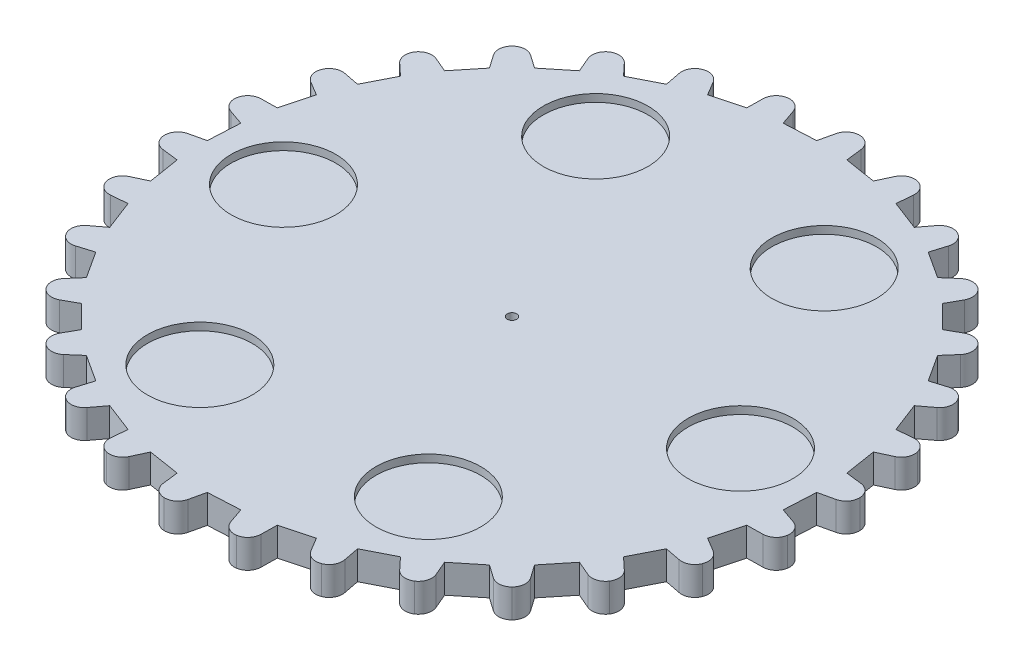
from build123d import *

# Parameters (mm, degrees)
BOSS_EXTRUDE2_DEPTH = 19.05
SKETCH3_R           = 34.925
CUT_EXTRUDE1_DEPTH  = 5.08
SKETCH4_R           = 3.175
CUT_EXTRUDE2_DEPTH  = 313.58717045


with BuildPart() as part:
    # Sketch2 → Boss-Extrude2 (new body)
    with BuildSketch(Plane(origin=(0, 0, 0), x_dir=(1, 0, 0), z_dir=(0, 1, 0))):
        with BuildLine():
            Line((42.247655574, 198.759592469), (0, 0))
            Line((0, 0), (0, 203.2))
            Line((0, 203.2), (-21.240183736, 202.086849139))
            Line((-21.240183736, 202.086849139), (-24.759086907, 212.306486006))
            ThreePointArc((-24.759086907, 212.306486006), (-28.586058558, 217.032402416), (-34.555449438, 218.192734461))
            Line((-34.555449438, 218.192734461), (-34.561077636, 218.191843042))
            ThreePointArc((-34.561077636, 218.191843042), (-39.87974341, 215.243658462), (-42.059021251, 209.566445587))
            Line((-42.059021251, 209.566445587), (-42.247655574, 198.759592469))
            Line((-42.247655574, 198.759592469), (-62.792253257, 193.254684111))
            Line((-62.792253257, 193.254684111), (-68.359041932, 202.519376285))
            ThreePointArc((-68.359041932, 202.519376285), (-73.084958342, 206.346347936), (-79.165150306, 206.24021779))
            Line((-79.165150306, 206.24021779), (-79.170470177, 206.238175683))
            ThreePointArc((-79.170470177, 206.238175683), (-83.759948302, 202.248603216), (-84.711244767, 196.242353723))
            Line((-84.711244767, 196.242353723), (-82.648885873, 185.632436993))
            Line((-82.648885873, 185.632436993), (-101.6, 175.976362049))
            Line((-101.6, 175.976362049), (-108.971378801, 183.881198024))
            ThreePointArc((-108.971378801, 183.881198024), (-114.389694745, 186.641967892), (-120.314954229, 185.274013953))
            Line((-120.314954229, 185.274013953), (-120.319733271, 185.270910407))
            ThreePointArc((-120.319733271, 185.270910407), (-123.97944153, 180.414313513), (-123.661180396, 174.341529326))
            Line((-123.661180396, 174.341529326), (-119.437963266, 164.392253257))
            Line((-119.437963266, 164.392253257), (-135.967339212, 151.007028537))
            Line((-135.967339212, 151.007028537), (-144.821143513, 157.206529051))
            ThreePointArc((-144.821143513, 157.206529051), (-150.695052585, 158.780438243), (-156.206417317, 156.210446662))
            Line((-156.206417317, 156.210446662), (-156.210446662, 156.206417317))
            ThreePointArc((-156.210446662, 156.206417317), (-158.780438243, 150.695052585), (-157.206529051, 144.821143513))
            Line((-157.206529051, 144.821143513), (-151.007028537, 135.967339212))
            Line((-151.007028537, 135.967339212), (-164.392253257, 119.437963266))
            Line((-164.392253257, 119.437963266), (-174.341529326, 123.661180396))
            ThreePointArc((-174.341529326, 123.661180396), (-180.414313513, 123.97944153), (-185.270910407, 120.319733271))
            Line((-185.270910407, 120.319733271), (-185.274013953, 120.314954229))
            ThreePointArc((-185.274013953, 120.314954229), (-186.641967892, 114.389694745), (-183.881198024, 108.971378801))
            Line((-183.881198024, 108.971378801), (-175.976362049, 101.6))
            Line((-175.976362049, 101.6), (-185.632436993, 82.648885873))
            Line((-185.632436993, 82.648885873), (-196.242353723, 84.711244767))
            ThreePointArc((-196.242353723, 84.711244767), (-202.248603216, 83.759948302), (-206.238175683, 79.170470177))
            Line((-206.238175683, 79.170470177), (-206.24021779, 79.165150306))
            ThreePointArc((-206.24021779, 79.165150306), (-206.346347936, 73.084958342), (-202.519376285, 68.359041932))
            Line((-202.519376285, 68.359041932), (-193.254684111, 62.792253257))
            Line((-193.254684111, 62.792253257), (-198.759592469, 42.247655574))
            Line((-198.759592469, 42.247655574), (-209.566445587, 42.059021251))
            ThreePointArc((-209.566445587, 42.059021251), (-215.243658462, 39.87974341), (-218.191843042, 34.561077636))
            Line((-218.191843042, 34.561077636), (-218.192734461, 34.555449438))
            ThreePointArc((-218.192734461, 34.555449438), (-217.032402416, 28.586058558), (-212.306486006, 24.759086907))
            Line((-212.306486006, 24.759086907), (-202.086849139, 21.240183736))
            Line((-202.086849139, 21.240183736), (-203.2, 0))
            Line((-203.2, 0), (-213.731478168, -2.431383314))
            ThreePointArc((-213.731478168, -2.431383314), (-218.831532979, -5.743397635), (-220.609479859, -11.558799841))
            Line((-220.609479859, -11.558799841), (-220.60918163, -11.564490385))
            ThreePointArc((-220.60918163, -11.564490385), (-218.233099473, -17.162189155), (-212.814783529, -19.922959023))
            Line((-212.814783529, -19.922959023), (-202.086849139, -21.240183736))
            Line((-202.086849139, -21.240183736), (-198.759592469, -42.247655574))
            Line((-198.759592469, -42.247655574), (-208.555419555, -46.815524762))
            ThreePointArc((-208.555419555, -46.815524762), (-212.855419435, -51.115524642), (-213.385423804, -57.1735023))
            Line((-213.385423804, -57.1735023), (-213.383948962, -57.179006487))
            ThreePointArc((-213.383948962, -57.179006487), (-209.895962885, -62.16036685), (-204.022053813, -63.734276042))
            Line((-204.022053813, -63.734276042), (-193.254684111, -62.792253257))
            Line((-193.254684111, -62.792253257), (-185.632436993, -82.648885873))
            Line((-185.632436993, -82.648885873), (-194.264488348, -89.153603132))
            ThreePointArc((-194.264488348, -89.153603132), (-197.576502668, -94.253657944), (-196.835400792, -100.289448359))
            Line((-196.835400792, -100.289448359), (-196.832813794, -100.294525629))
            ThreePointArc((-196.832813794, -100.294525629), (-192.385365526, -104.441838234), (-186.312581339, -104.760099367))
            Line((-186.312581339, -104.760099367), (-175.976362049, -101.6))
            Line((-175.976362049, -101.6), (-164.392253257, -119.437963266))
            Line((-164.392253257, -119.437963266), (-171.483266816, -127.595241239))
            ThreePointArc((-171.483266816, -127.595241239), (-173.662544657, -133.272454113), (-171.682726245, -139.022264283))
            Line((-171.682726245, -139.022264283), (-171.679140155, -139.026692735))
            ThreePointArc((-171.679140155, -139.026692735), (-166.466604526, -142.15870012), (-160.460355034, -141.207403655))
            Line((-160.460355034, -141.207403655), (-151.007028537, -135.967339212))
            Line((-151.007028537, -135.967339212), (-135.967339212, -151.007028537))
            Line((-135.967339212, -151.007028537), (-141.207403655, -160.460355034))
            ThreePointArc((-141.207403655, -160.460355034), (-142.15870012, -166.466604526), (-139.026692735, -171.679140155))
            Line((-139.026692735, -171.679140155), (-139.022264283, -171.682726245))
            ThreePointArc((-139.022264283, -171.682726245), (-133.272454113, -173.662544657), (-127.595241239, -171.483266816))
            Line((-127.595241239, -171.483266816), (-119.437963266, -164.392253257))
            Line((-119.437963266, -164.392253257), (-101.6, -175.976362049))
            Line((-101.6, -175.976362049), (-104.760099367, -186.312581339))
            ThreePointArc((-104.760099367, -186.312581339), (-104.441838234, -192.385365526), (-100.294525629, -196.832813794))
            Line((-100.294525629, -196.832813794), (-100.289448359, -196.835400792))
            ThreePointArc((-100.289448359, -196.835400792), (-94.253657944, -197.576502668), (-89.153603132, -194.264488348))
            Line((-89.153603132, -194.264488348), (-82.648885873, -185.632436993))
            Line((-82.648885873, -185.632436993), (-62.792253257, -193.254684111))
            Line((-62.792253257, -193.254684111), (-63.734276042, -204.022053813))
            ThreePointArc((-63.734276042, -204.022053813), (-62.16036685, -209.895962885), (-57.179006487, -213.383948962))
            Line((-57.179006487, -213.383948962), (-57.1735023, -213.385423804))
            ThreePointArc((-57.1735023, -213.385423804), (-51.115524642, -212.855419435), (-46.815524762, -208.555419555))
            Line((-46.815524762, -208.555419555), (-42.247655574, -198.759592469))
            Line((-42.247655574, -198.759592469), (-21.240183736, -202.086849139))
            Line((-21.240183736, -202.086849139), (-19.922959023, -212.814783529))
            ThreePointArc((-19.922959023, -212.814783529), (-17.162189155, -218.233099473), (-11.564490385, -220.60918163))
            Line((-11.564490385, -220.60918163), (-11.558799841, -220.609479859))
            ThreePointArc((-11.558799841, -220.609479859), (-5.743397635, -218.831532979), (-2.431383314, -213.731478168))
            Line((-2.431383314, -213.731478168), (0, -203.2))
            Line((0, -203.2), (21.240183736, -202.086849139))
            Line((21.240183736, -202.086849139), (24.759086907, -212.306486006))
            ThreePointArc((24.759086907, -212.306486006), (28.586058558, -217.032402416), (34.555449438, -218.192734461))
            Line((34.555449438, -218.192734461), (34.561077636, -218.191843042))
            ThreePointArc((34.561077636, -218.191843042), (39.87974341, -215.243658462), (42.059021251, -209.566445587))
            Line((42.059021251, -209.566445587), (42.247655574, -198.759592469))
            Line((42.247655574, -198.759592469), (62.792253257, -193.254684111))
            Line((62.792253257, -193.254684111), (68.359041932, -202.519376285))
            ThreePointArc((68.359041932, -202.519376285), (73.084958342, -206.346347936), (79.165150306, -206.24021779))
            Line((79.165150306, -206.24021779), (79.170470177, -206.238175683))
            ThreePointArc((79.170470177, -206.238175683), (83.759948302, -202.248603216), (84.711244767, -196.242353723))
            Line((84.711244767, -196.242353723), (82.648885873, -185.632436993))
            Line((82.648885873, -185.632436993), (101.6, -175.976362049))
            Line((101.6, -175.976362049), (108.971378801, -183.881198024))
            ThreePointArc((108.971378801, -183.881198024), (114.389694745, -186.641967892), (120.314954229, -185.274013953))
            Line((120.314954229, -185.274013953), (120.319733271, -185.270910407))
            ThreePointArc((120.319733271, -185.270910407), (123.97944153, -180.414313513), (123.661180396, -174.341529326))
            Line((123.661180396, -174.341529326), (119.437963266, -164.392253257))
            Line((119.437963266, -164.392253257), (135.967339212, -151.007028537))
            Line((135.967339212, -151.007028537), (144.821143513, -157.206529051))
            ThreePointArc((144.821143513, -157.206529051), (150.695052585, -158.780438243), (156.206417317, -156.210446662))
            Line((156.206417317, -156.210446662), (156.210446662, -156.206417317))
            ThreePointArc((156.210446662, -156.206417317), (158.780438243, -150.695052585), (157.206529051, -144.821143513))
            Line((157.206529051, -144.821143513), (151.007028537, -135.967339212))
            Line((151.007028537, -135.967339212), (164.392253257, -119.437963266))
            Line((164.392253257, -119.437963266), (174.341529326, -123.661180396))
            ThreePointArc((174.341529326, -123.661180396), (180.414313513, -123.97944153), (185.270910407, -120.319733271))
            Line((185.270910407, -120.319733271), (185.274013953, -120.314954229))
            ThreePointArc((185.274013953, -120.314954229), (186.641967892, -114.389694745), (183.881198024, -108.971378801))
            Line((183.881198024, -108.971378801), (175.976362049, -101.6))
            Line((175.976362049, -101.6), (185.632436993, -82.648885873))
            Line((185.632436993, -82.648885873), (196.242353723, -84.711244767))
            ThreePointArc((196.242353723, -84.711244767), (202.248603216, -83.759948302), (206.238175683, -79.170470177))
            Line((206.238175683, -79.170470177), (206.24021779, -79.165150306))
            ThreePointArc((206.24021779, -79.165150306), (206.346347936, -73.084958342), (202.519376285, -68.359041932))
            Line((202.519376285, -68.359041932), (193.254684111, -62.792253257))
            Line((193.254684111, -62.792253257), (198.759592469, -42.247655574))
            Line((198.759592469, -42.247655574), (209.566445587, -42.059021251))
            ThreePointArc((209.566445587, -42.059021251), (215.243658462, -39.87974341), (218.191843042, -34.561077636))
            Line((218.191843042, -34.561077636), (218.192734461, -34.555449438))
            ThreePointArc((218.192734461, -34.555449438), (217.032402416, -28.586058558), (212.306486006, -24.759086907))
            Line((212.306486006, -24.759086907), (202.086849139, -21.240183736))
            Line((202.086849139, -21.240183736), (203.2, 0))
            Line((203.2, 0), (213.731478168, 2.431383314))
            ThreePointArc((213.731478168, 2.431383314), (218.831532979, 5.743397635), (220.609479859, 11.558799841))
            Line((220.609479859, 11.558799841), (220.60918163, 11.564490385))
            ThreePointArc((220.60918163, 11.564490385), (218.233099473, 17.162189155), (212.814783529, 19.922959023))
            Line((212.814783529, 19.922959023), (202.086849139, 21.240183736))
            Line((202.086849139, 21.240183736), (198.759592469, 42.247655574))
            Line((198.759592469, 42.247655574), (208.555419555, 46.815524762))
            ThreePointArc((208.555419555, 46.815524762), (212.855419435, 51.115524642), (213.385423804, 57.1735023))
            Line((213.385423804, 57.1735023), (213.383948962, 57.179006487))
            ThreePointArc((213.383948962, 57.179006487), (209.895962885, 62.16036685), (204.022053813, 63.734276042))
            Line((204.022053813, 63.734276042), (193.254684111, 62.792253257))
            Line((193.254684111, 62.792253257), (185.632436993, 82.648885873))
            Line((185.632436993, 82.648885873), (194.264488348, 89.153603132))
            ThreePointArc((194.264488348, 89.153603132), (197.576502668, 94.253657944), (196.835400792, 100.289448359))
            Line((196.835400792, 100.289448359), (196.832813794, 100.294525629))
            ThreePointArc((196.832813794, 100.294525629), (192.385365526, 104.441838234), (186.312581339, 104.760099367))
            Line((186.312581339, 104.760099367), (175.976362049, 101.6))
            Line((175.976362049, 101.6), (164.392253257, 119.437963266))
            Line((164.392253257, 119.437963266), (171.483266816, 127.595241239))
            ThreePointArc((171.483266816, 127.595241239), (173.662544657, 133.272454113), (171.682726245, 139.022264283))
            Line((171.682726245, 139.022264283), (171.679140155, 139.026692735))
            ThreePointArc((171.679140155, 139.026692735), (166.466604526, 142.15870012), (160.460355034, 141.207403655))
            Line((160.460355034, 141.207403655), (151.007028537, 135.967339212))
            Line((151.007028537, 135.967339212), (135.967339212, 151.007028537))
            Line((135.967339212, 151.007028537), (141.207403655, 160.460355034))
            ThreePointArc((141.207403655, 160.460355034), (142.15870012, 166.466604526), (139.026692735, 171.679140155))
            Line((139.026692735, 171.679140155), (139.022264283, 171.682726245))
            ThreePointArc((139.022264283, 171.682726245), (133.272454113, 173.662544657), (127.595241239, 171.483266816))
            Line((127.595241239, 171.483266816), (119.437963266, 164.392253257))
            Line((119.437963266, 164.392253257), (101.6, 175.976362049))
            Line((101.6, 175.976362049), (104.760099367, 186.312581339))
            ThreePointArc((104.760099367, 186.312581339), (104.441838234, 192.385365526), (100.294525629, 196.832813794))
            Line((100.294525629, 196.832813794), (100.289448359, 196.835400792))
            ThreePointArc((100.289448359, 196.835400792), (94.253657944, 197.576502668), (89.153603132, 194.264488348))
            Line((89.153603132, 194.264488348), (82.648885873, 185.632436993))
            Line((82.648885873, 185.632436993), (62.792253257, 193.254684111))
            Line((62.792253257, 193.254684111), (63.734276042, 204.022053813))
            ThreePointArc((63.734276042, 204.022053813), (62.16036685, 209.895962885), (57.179006487, 213.383948962))
            Line((57.179006487, 213.383948962), (57.1735023, 213.385423804))
            ThreePointArc((57.1735023, 213.385423804), (51.115524642, 212.855419435), (46.815524762, 208.555419555))
            Line((46.815524762, 208.555419555), (42.247655574, 198.759592469))
        make_face()
        Polygon((21.240183736, 202.086849139), (0, 0), (42.247655574, 198.759592469), align=None)
        with BuildLine():
            Line((0, 203.2), (0, 0))
            Line((0, 0), (21.240183736, 202.086849139))
            Line((21.240183736, 202.086849139), (19.922959023, 212.814783529))
            ThreePointArc((19.922959023, 212.814783529), (17.162189155, 218.233099473), (11.564490385, 220.60918163))
            Line((11.564490385, 220.60918163), (11.558799841, 220.609479859))
            ThreePointArc((11.558799841, 220.609479859), (5.743397635, 218.831532979), (2.431383314, 213.731478168))
            Line((2.431383314, 213.731478168), (0, 203.2))
        make_face()
    extrude(amount=BOSS_EXTRUDE2_DEPTH)

    # Sketch3 → Cut-Extrude1 (cut)
    with BuildSketch(Plane(origin=(0, 19.05, 0), x_dir=(1, 0, 0), z_dir=(0, 1, 0))):
        with Locations(Location((-152.4, 0, 0), (0, 0, 270))):
            Circle(SKETCH3_R)
        with Locations(Location((-76.2, 131.982271537, 0), (0, 0, 270))):
            Circle(SKETCH3_R)
        with Locations(Location((76.2, 131.982271537, 0), (0, 0, 270))):
            Circle(SKETCH3_R)
        with Locations(Location((152.4, 0, 0), (0, 0, 270))):
            Circle(SKETCH3_R)
        with Locations(Location((76.2, -131.982271537, 0), (0, 0, 270))):
            Circle(SKETCH3_R)
        with Locations(Location((-76.2, -131.982271537, 0), (0, 0, 270))):
            Circle(SKETCH3_R)
    extrude(amount=-CUT_EXTRUDE1_DEPTH, mode=Mode.SUBTRACT)

    # Sketch4 → Cut-Extrude2 (cut, through all)
    with BuildSketch(Plane(origin=(0, 19.05, 0), x_dir=(1, 0, 0), z_dir=(0, 1, 0))):
        with Locations(Location((0, 0, 0), (0, 0, 270))):
            Circle(SKETCH4_R)
    extrude(amount=-CUT_EXTRUDE2_DEPTH, mode=Mode.SUBTRACT)


solid = part.part
